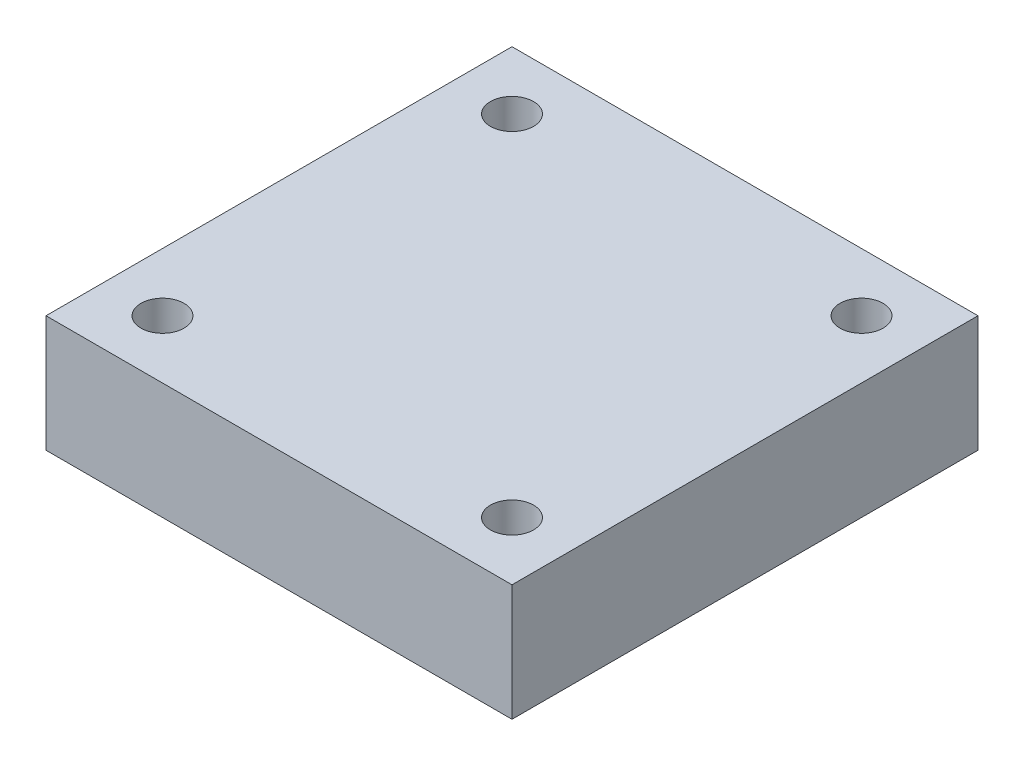
from build123d import *

# Parameters (mm, degrees)
SKETCH1_W           = 40
SKETCH1_H           = 40
SKETCH1_R           = 1.85
BOSS_EXTRUDE1_DEPTH = 10


with BuildPart() as part:
    # Sketch1 → Boss-Extrude1 (new body)
    with BuildSketch(Plane(origin=(0, 0, 0), x_dir=(1, 0, 0), z_dir=(0, 1, 0))):
        Rectangle(SKETCH1_W, SKETCH1_H)
        with Locations(Location((-15, 15, 0), (0, 0, 270))):
            Circle(SKETCH1_R, mode=Mode.SUBTRACT)
        with Locations(Location((15, -15, 0), (0, 0, 90))):
            Circle(SKETCH1_R, mode=Mode.SUBTRACT)
        with Locations(Location((15, 15, 0), (0, 0, 270))):
            Circle(SKETCH1_R, mode=Mode.SUBTRACT)
        with Locations(Location((-15, -15, 0), (0, 0, 90))):
            Circle(SKETCH1_R, mode=Mode.SUBTRACT)
    extrude(amount=BOSS_EXTRUDE1_DEPTH)


solid = part.part
